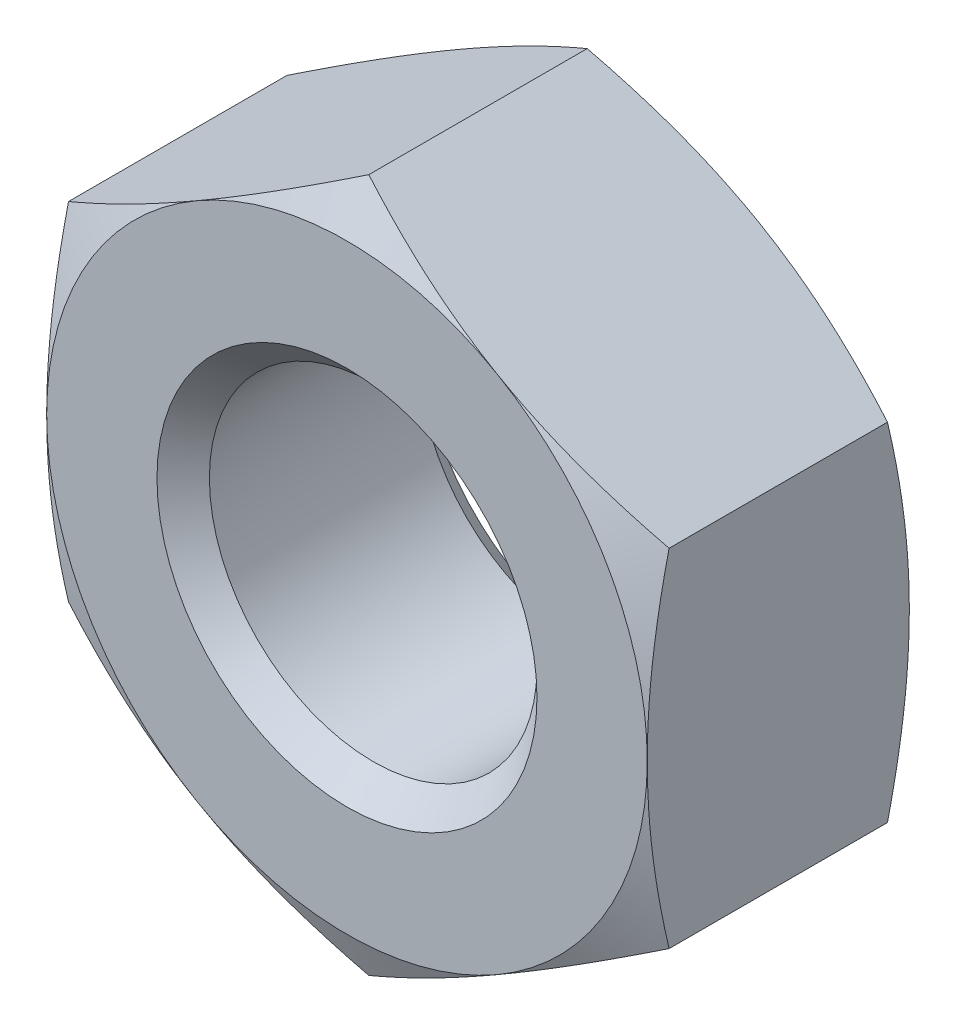
from build123d import *

# Parameters (mm, degrees)
SKETCH1_R           = 1.5
BOSS_EXTRUDE1_DEPTH = 2.4


with BuildPart() as part:
    # Sketch1 → Boss-Extrude1 (new body)
    with BuildSketch(Plane.XY):
        Polygon((0, -3.175426481), (2.75, -1.58771324), (2.75, 1.58771324), (0, 3.175426481), (-2.75, 1.58771324), (-2.75, -1.58771324), align=None)
        Circle(SKETCH1_R, mode=Mode.SUBTRACT)
    extrude(amount=BOSS_EXTRUDE1_DEPTH)

    # Sketch2 → Cut-Revolve1 (revolve, cut)
    with BuildSketch(Plane(origin=(0, 0, 0), x_dir=(0, 0, -1), z_dir=(1, 0, 0))):
        Polygon((-2.4, 3.175426481), (-2.4, 2.75), (-2.2, 3.175426481), align=None)
        Polygon((-0.2, 3.175426481), (0, 3.175426481), (0, 2.75), align=None)
        Polygon((-2.4, 1.5), (-2.16, 1.5), (-2.4, 1.74), align=None)
        Polygon((0, 1.5), (-0.24, 1.5), (0, 1.74), align=None)
    revolve(axis=Axis((0, 0, 0), (0, 0, 1)), mode=Mode.SUBTRACT)


solid = part.part
